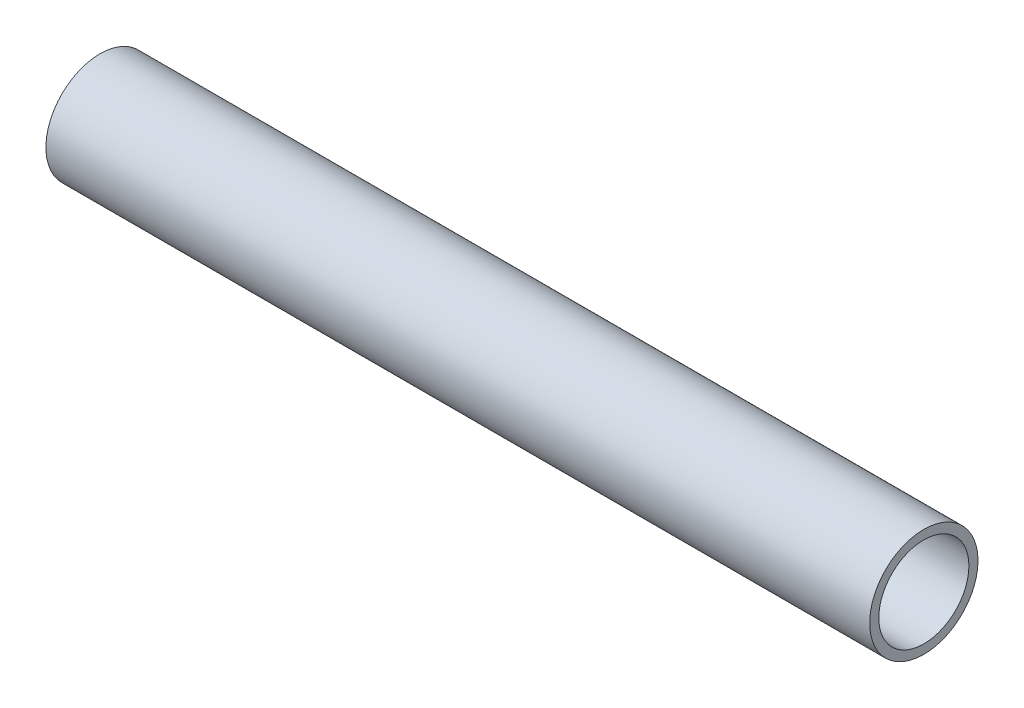
from build123d import *

# Parameters (mm, degrees)
SKETCH11_R              = 6.35
SKETCH11_R_2            = 5.2832
PIPE_0_5_SCH_40_1_DEPTH = 96.581832053


with BuildPart() as part:
    # Sketch11 → Pipe 0.5 SCH 40(1) (new body)
    with BuildSketch(Plane(origin=(-135.350259129, 1471.859674504, 0), x_dir=(0, 1, 0), z_dir=(1, 0, 0))):
        Circle(SKETCH11_R)
        Circle(SKETCH11_R_2, mode=Mode.SUBTRACT)
    extrude(amount=PIPE_0_5_SCH_40_1_DEPTH)


solid = part.part
